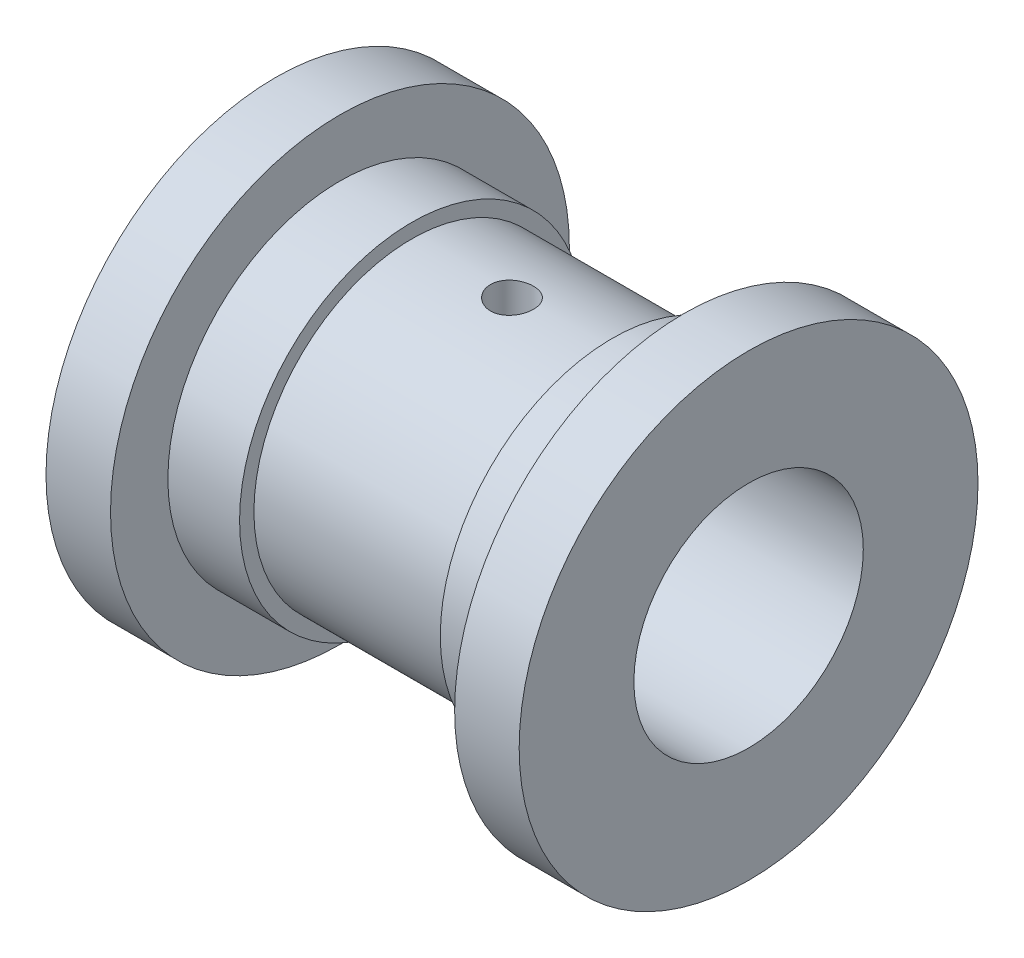
from build123d import *

# Parameters (mm, degrees)
CUT_EXTRUDE1_DEPTH      = 57.00892786
CUT_EXTRUDE1_DEPTH_BACK = 57.00892786
SKETCH1_4_R             = 3
CUT_EXTRUDE2_DEPTH      = 81.024996095
CUT_EXTRUDE2_DEPTH_BACK = 81.024996095
SKETCH2_R               = 16


with BuildPart() as part:
    # Sketch1 → Revolve8 (revolve)
    with BuildSketch(Plane(origin=(0, 0, 0), x_dir=(1, 0, 0), z_dir=(0, 1, 0))):
        Polygon((33, 0), (33, 32), (24, 32), (24, 24), (14, 24), (14, 22), (-14, 22), (-14, 24), (-24, 24), (-24, 32), (-33, 32), (-33, 0), align=None)
    revolve(axis=Axis((-33, 0, 0), (1, 0, 0)))

    # Sketch1<4> → Cut-Extrude1 (cut, two sides: drawn at the far end of the back side and taken through both)
    with BuildSketch(Plane(origin=(0, 0, 0), x_dir=(1, 0, 0), z_dir=(0, 1, 0)).offset(-CUT_EXTRUDE1_DEPTH_BACK)):
        Circle(SKETCH1_4_R)
    extrude(amount=CUT_EXTRUDE1_DEPTH + CUT_EXTRUDE1_DEPTH_BACK, mode=Mode.SUBTRACT)

    # Sketch2 → Cut-Extrude2 (cut, two sides: drawn at the far end of the back side and taken through both)
    with BuildSketch(Plane(origin=(33, 0, 0), x_dir=(0, 0, -1), z_dir=(1, 0, 0)).offset(-CUT_EXTRUDE2_DEPTH_BACK)):
        Circle(SKETCH2_R)
    extrude(amount=CUT_EXTRUDE2_DEPTH + CUT_EXTRUDE2_DEPTH_BACK, mode=Mode.SUBTRACT)


solid = part.part
